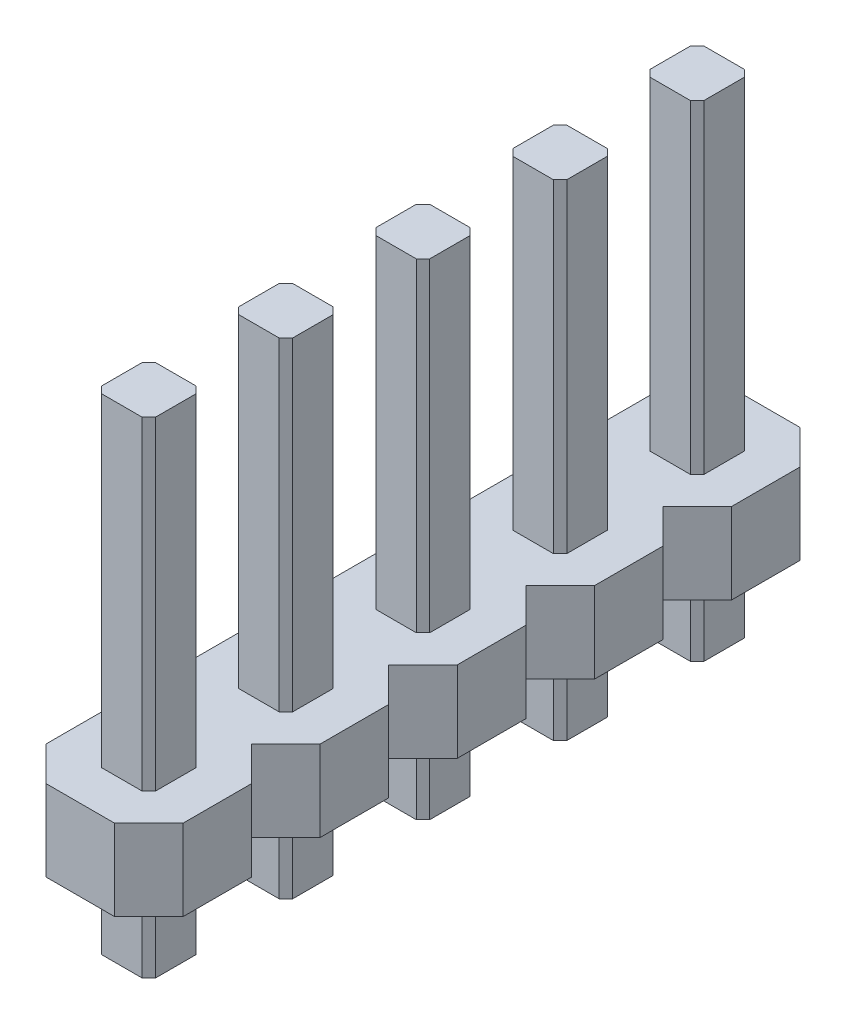
from build123d import *

# Parameters (mm, degrees)
BOSS_EXTRUDE1_DEPTH      = 1.5
BOSS_EXTRUDE2_DEPTH      = 6
BOSS_EXTRUDE2_DEPTH_BACK = 3


with BuildPart() as part:
    # Sketch1 → Boss-Extrude1 (new body)
    with BuildSketch(Plane(origin=(0, 0, 0), x_dir=(1, 0, 0), z_dir=(0, 1, 0))):
        Polygon((-0.635, 1.27), (0.635, 1.27), (1.27, 0.635), (1.27, -0.635), (0.635, -1.27), (1.27, -1.905), (1.27, -3.175), (0.635, -3.81), (1.27, -4.445), (1.27, -5.715), (0.635, -6.35), (1.27, -6.985), (1.27, -8.255), (0.635, -8.89), (1.27, -9.525), (1.27, -10.795), (0.635, -11.43), (-0.635, -11.43), (-1.27, -10.795), (-1.27, -9.525), (-0.635, -8.89), (-1.27, -8.255), (-1.27, -6.985), (-0.635, -6.35), (-1.27, -5.715), (-1.27, -4.445), (-0.635, -3.81), (-1.27, -3.175), (-1.27, -1.905), (-0.635, -1.27), (-1.27, -0.635), (-1.27, 0.635), align=None)
    extrude(amount=BOSS_EXTRUDE1_DEPTH)

    # Sketch2 → Boss-Extrude2 (add, two sides: drawn at the far end of the back side and taken through both)
    with BuildSketch(Plane(origin=(0, 1.5, 0), x_dir=(1, 0, 0), z_dir=(0, 1, 0)).offset(-BOSS_EXTRUDE2_DEPTH_BACK)):
        Polygon((0.5, 0.375), (0.375, 0.5), (-0.375, 0.5), (-0.5, 0.375), (-0.5, -0.375), (-0.375, -0.5), (0.375, -0.5), (0.5, -0.375), align=None)
        Polygon((0.5, -2.165), (0.375, -2.04), (-0.375, -2.04), (-0.5, -2.165), (-0.5, -2.915), (-0.375, -3.04), (0.375, -3.04), (0.5, -2.915), align=None)
        Polygon((0.5, -4.705), (0.375, -4.58), (-0.375, -4.58), (-0.5, -4.705), (-0.5, -5.455), (-0.375, -5.58), (0.375, -5.58), (0.5, -5.455), align=None)
        Polygon((0.5, -7.245), (0.375, -7.12), (-0.375, -7.12), (-0.5, -7.245), (-0.5, -7.995), (-0.375, -8.12), (0.375, -8.12), (0.5, -7.995), align=None)
        Polygon((0.5, -9.785), (0.375, -9.66), (-0.375, -9.66), (-0.5, -9.785), (-0.5, -10.535), (-0.375, -10.66), (0.375, -10.66), (0.5, -10.535), align=None)
    extrude(amount=BOSS_EXTRUDE2_DEPTH + BOSS_EXTRUDE2_DEPTH_BACK)


solid = part.part
